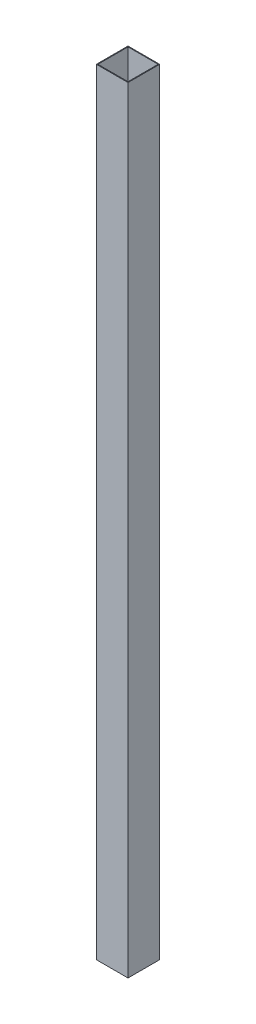
from build123d import *

# Parameters (mm, degrees)
SKETCH2_W           = 25.4
SKETCH2_H           = 25.4
SKETCH2_W_2         = 24.2
SKETCH2_H_2         = 24.2
EXTRUDE_THIN1_DEPTH = 622.3


with BuildPart() as part:
    # Sketch2 → Extrude-Thin1 (new body)
    with BuildSketch(Plane(origin=(0, 0, 0), x_dir=(1, 0, 0), z_dir=(0, 1, 0))):
        with Locations((12.7, 12.7)):
            Rectangle(SKETCH2_W, SKETCH2_H)
        with Locations((12.7, 12.7)):
            Rectangle(SKETCH2_W_2, SKETCH2_H_2, mode=Mode.SUBTRACT)
    extrude(amount=EXTRUDE_THIN1_DEPTH)


solid = part.part
